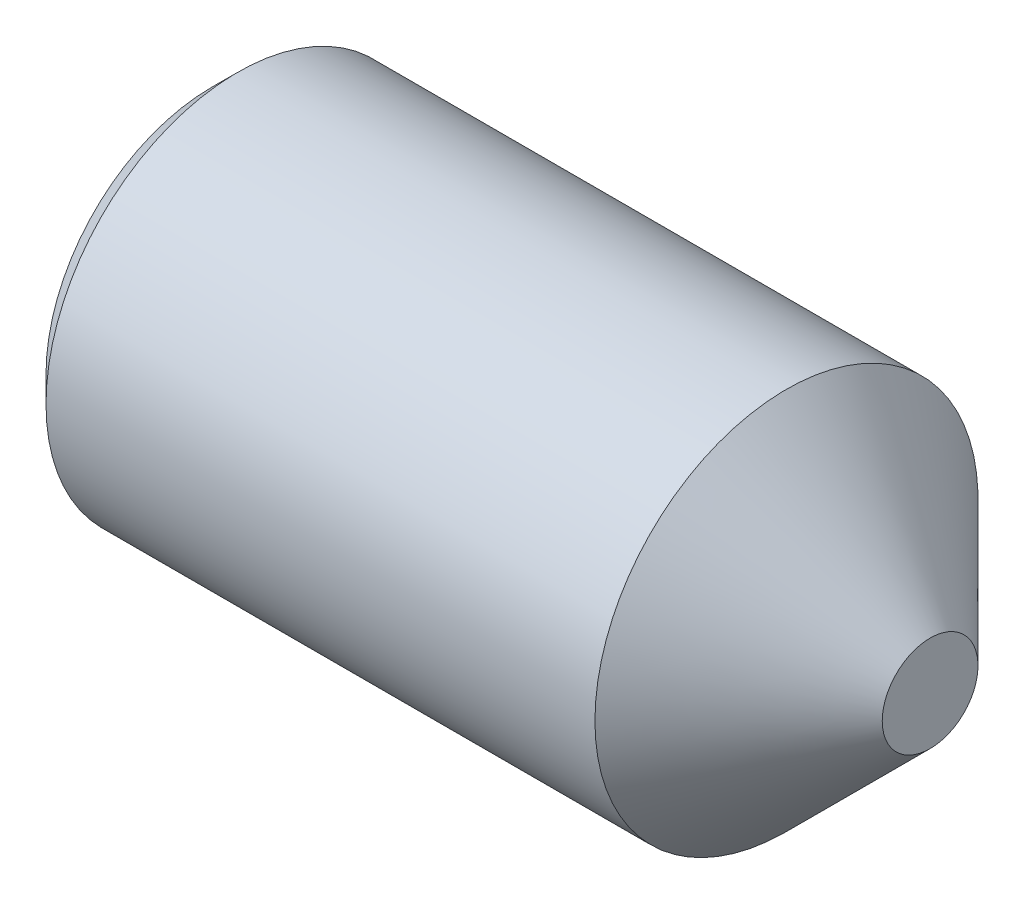
from build123d import *

# Parameters (mm, degrees)
CUT_EXTRUDE_1_DEPTH = 10


with BuildPart() as part:
    # 草图1 → Revolve 543 (revolve)
    with BuildSketch(Plane.XY, mode=Mode.PRIVATE) as revolve_543_sk:
        Polygon((0, 0), (30, 0), (30, 2), (24, 8), (1.072, 8), (0, 6.928), align=None)
    revolve(revolve_543_sk.sketch.rotate(Axis((-1.4104518, 0, 0), (1, 0, 0)), 90), axis=Axis((-1.4104518, 0, 0), (1, 0, 0)))

    # 草图2 → 切除-拉伸1 (cut)
    with BuildSketch(Plane.ZY):
        Polygon((4.5745, 0), (2.28725, 3.96163321), (-2.28725, 3.96163321), (-4.5745, 0), (-2.28725, -3.96163321), (2.28725, -3.96163321), align=None)
    extrude(amount=-CUT_EXTRUDE_1_DEPTH, mode=Mode.SUBTRACT)

    # 草图3 → 切除-旋转1 (revolve, cut)
    with BuildSketch(Plane.XY, mode=Mode.PRIVATE) as cut_revolve_1_sk:
        Polygon((10, 3.96163321), (12.28725, 0), (10, 0), align=None)
    revolve(cut_revolve_1_sk.sketch.rotate(Axis((-0.121283255, 0, 0), (1, 0, 0)), 90), axis=Axis((-0.121283255, 0, 0), (1, 0, 0)), mode=Mode.SUBTRACT)


solid = part.part
